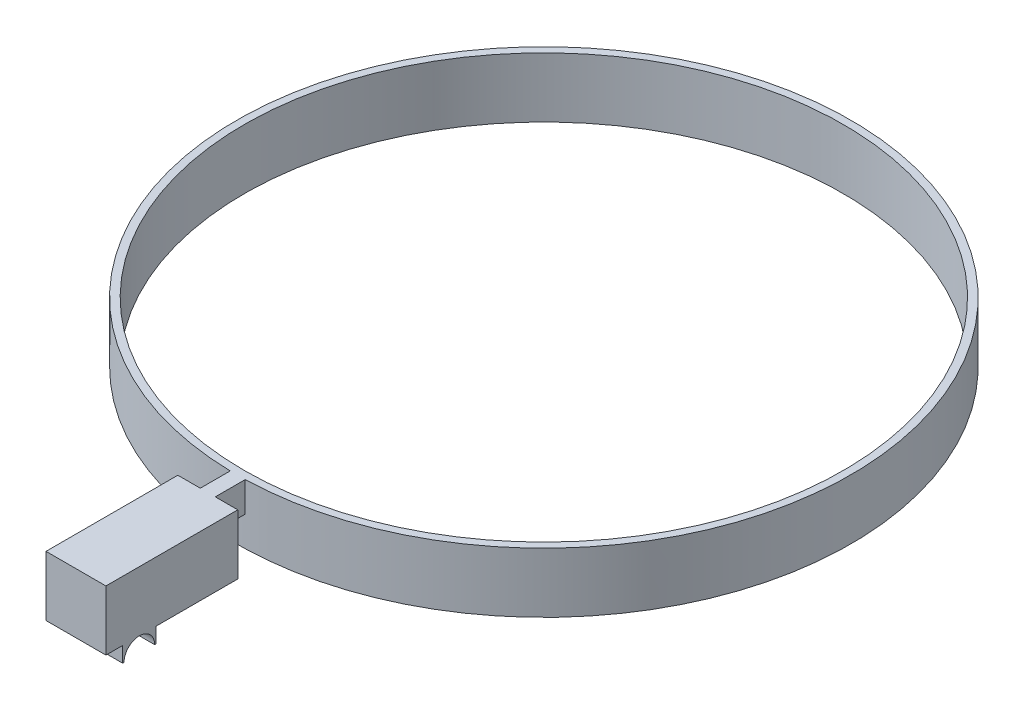
from build123d import *

# Parameters (mm, degrees)
SKETCH1_R           = 102.5
SKETCH1_R_2         = 100
BOSS_EXTRUDE1_DEPTH = 20
BOSS_EXTRUDE2_START = -10
BOSS_EXTRUDE2_DEPTH = 10
SKETCH3_W           = 20
SKETCH3_H           = 20
BOSS_EXTRUDE3_DEPTH = 44
BOSS_EXTRUDE5_DEPTH = 20


with BuildPart() as part:
    # Sketch1 → Boss-Extrude1 (new body)
    with BuildSketch(Plane(origin=(0, 0, 0), x_dir=(1, 0, 0), z_dir=(0, 1, 0))):
        with Locations(Location((0, 0, 0), (0, 0, 270))):
            Circle(SKETCH1_R)
        with Locations(Location((0, 0, 0), (0, 0, 270))):
            Circle(SKETCH1_R_2, mode=Mode.SUBTRACT)
    extrude(amount=BOSS_EXTRUDE1_DEPTH)

    # Sketch2 → Boss-Extrude2 (add)
    with BuildSketch(Plane(origin=(0, 20, 0), x_dir=(1, 0, 0), z_dir=(0, 1, 0)).offset(BOSS_EXTRUDE2_START)):
        with BuildLine():
            ThreePointArc((2.798561789, -102.461788253), (0.298650634, -102.499564915), (-2.201438211, -102.476356638))
            Line((-2.201438211, -102.476356638), (-2.201438211, -112.461788253))
            Line((-2.201438211, -112.461788253), (2.798561789, -112.461788253))
            Line((2.798561789, -112.461788253), (2.798561789, -102.461788253))
        make_face()
    extrude(amount=BOSS_EXTRUDE2_DEPTH)

    # Sketch3 → Boss-Extrude3 (add)
    with BuildSketch(Plane.XY.offset(112.461788253)):
        with Locations((0.298561789, 10)):
            Rectangle(SKETCH3_W, SKETCH3_H)
    extrude(amount=BOSS_EXTRUDE3_DEPTH)

    # Sketch4 → Boss-Extrude5 (add)
    with BuildSketch(Plane.ZY.offset(9.701438211)):
        with BuildLine():
            Line((145.311788254, 0), (139.711788253, 0))
            Line((139.711788253, 0), (139.711788253, -5.1))
            Line((139.711788253, -5.1), (140.211788253, -5.1))
            ThreePointArc((140.211788253, -5.1), (141.705543669, -1.493755415), (145.311788254, 0))
        make_face()
        with BuildLine():
            Line((150.911788253, 0), (145.311788254, 0))
            ThreePointArc((145.311788254, 0), (148.918032837, -1.493755416), (150.411788253, -5.1))
            Line((150.411788253, -5.1), (150.911788253, -5.1))
            Line((150.911788253, -5.1), (150.911788253, 0))
        make_face()
    extrude(amount=-BOSS_EXTRUDE5_DEPTH)


solid = part.part
